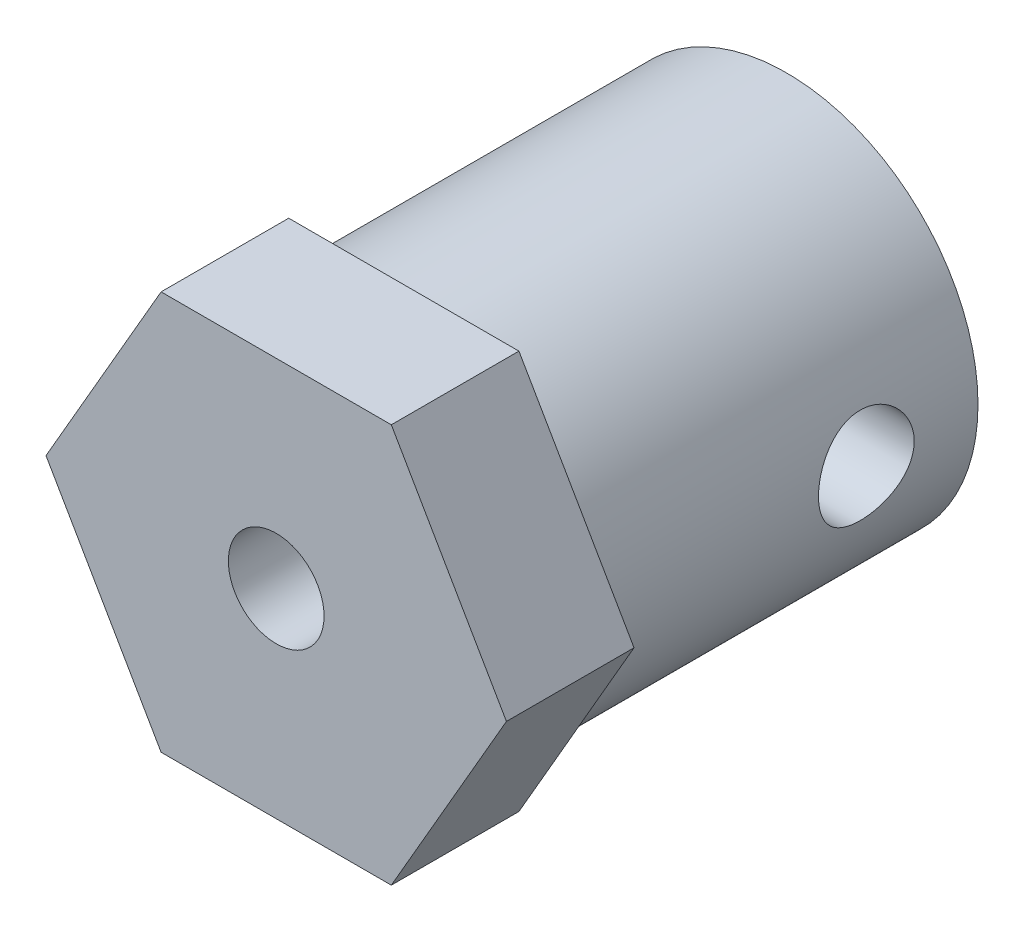
from build123d import *

# Parameters (mm, degrees)
CROQUIS2_R              = 1.5
SALIENTE_EXTRUIR1_DEPTH = 4
CROQUIS3_R              = 6
CROQUIS3_R_2            = 3.175
SALIENTE_EXTRUIR2_DEPTH = 12
CROQUIS4_R              = 1.5
CORTAR_EXTRUIR1_DEPTH   = 10


with BuildPart() as part:
    # Croquis2 → Saliente-Extruir1 (new body)
    with BuildSketch(Plane.XY):
        Polygon((3.608439182, 6.25), (-3.608439182, 6.25), (-7.216878365, 0), (-3.608439182, -6.25), (3.608439182, -6.25), (7.216878365, 0), align=None)
        Circle(CROQUIS2_R, mode=Mode.SUBTRACT)
    extrude(amount=SALIENTE_EXTRUIR1_DEPTH)

    # Croquis3 → Saliente-Extruir2 (add)
    with BuildSketch(Plane(origin=(0, 0, 0), x_dir=(-1, 0, 0), z_dir=(0, 0, -1))):
        Circle(CROQUIS3_R)
        Circle(CROQUIS3_R_2, mode=Mode.SUBTRACT)
    extrude(amount=SALIENTE_EXTRUIR2_DEPTH)

    # Croquis4 → Cortar-Extruir1 (cut)
    with BuildSketch(Plane(origin=(0, 0, 0), x_dir=(0, 0, -1), z_dir=(1, 0, 0))):
        with Locations((8.5, 0)):
            Circle(CROQUIS4_R)
    extrude(amount=CORTAR_EXTRUIR1_DEPTH, mode=Mode.SUBTRACT)


solid = part.part
